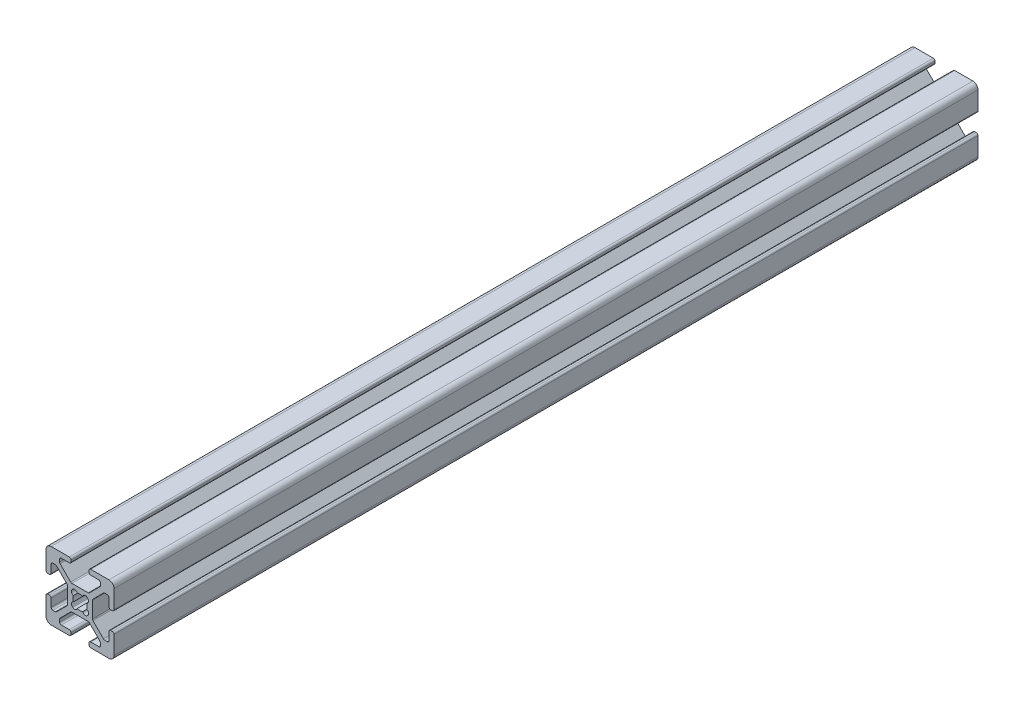
from build123d import *

# Parameters (mm, degrees)
BOSS_EXTRUDE1_DEPTH = 254


with BuildPart() as part:
    # Sketch2 → Boss-Extrude1 (new body)
    with BuildSketch(Plane.XY):
        with BuildLine():
            Line((-10, -3.138), (-10, -8.5))
            ThreePointArc((-10, -8.5), (-9.560660172, -9.560660172), (-8.5, -10))
            Line((-8.5, -10), (-3.138, -10))
            ThreePointArc((-3.138, -10), (-2.778789755, -9.851210245), (-2.63, -9.492))
            Line((-2.63, -9.492), (-2.63, -9.008))
            ThreePointArc((-2.63, -9.008), (-2.778789755, -8.648789755), (-3.138, -8.5))
            Line((-3.138, -8.5), (-5.487, -8.5))
            ThreePointArc((-5.487, -8.5), (-5.846210245, -8.351210245), (-5.995, -7.992))
            Line((-5.995, -7.992), (-5.995, -7.266240833))
            ThreePointArc((-5.995, -7.266240833), (-5.956330803, -7.07183765), (-5.846210245, -6.907030588))
            Line((-5.846210245, -6.907030588), (-2.742969412, -3.803789755))
            ThreePointArc((-2.742969412, -3.803789755), (-2.57816235, -3.693669197), (-2.383759167, -3.655))
            Line((-2.383759167, -3.655), (2.38407951, -3.655))
            ThreePointArc((2.38407951, -3.655), (2.578482694, -3.693669197), (2.743289755, -3.803789755))
            Line((2.743289755, -3.803789755), (5.846210245, -6.906710245))
            ThreePointArc((5.846210245, -6.906710245), (5.956330803, -7.071517306), (5.995, -7.26592049))
            Line((5.995, -7.26592049), (5.995, -7.992))
            ThreePointArc((5.995, -7.992), (5.846210245, -8.351210245), (5.487, -8.5))
            Line((5.487, -8.5), (3.138, -8.5))
            ThreePointArc((3.138, -8.5), (2.778789755, -8.648789755), (2.63, -9.008))
            Line((2.63, -9.008), (2.63, -9.492))
            ThreePointArc((2.63, -9.492), (2.778789755, -9.851210245), (3.138, -10))
            Line((3.138, -10), (8.5, -10))
            ThreePointArc((8.5, -10), (9.560660172, -9.560660172), (10, -8.5))
            Line((10, -8.5), (10, -3.138))
            ThreePointArc((10, -3.138), (9.851210245, -2.778789755), (9.492, -2.63))
            Line((9.492, -2.63), (9.008, -2.63))
            ThreePointArc((9.008, -2.63), (8.648789755, -2.778789755), (8.5, -3.138))
            Line((8.5, -3.138), (8.5, -5.487))
            ThreePointArc((8.5, -5.487), (8.351210245, -5.846210245), (7.992, -5.995))
            Line((7.992, -5.995), (7.266240833, -5.995))
            ThreePointArc((7.266240833, -5.995), (7.07183765, -5.956330803), (6.907030588, -5.846210245))
            Line((6.907030588, -5.846210245), (3.803789755, -2.742969412))
            ThreePointArc((3.803789755, -2.742969412), (3.693669197, -2.57816235), (3.655, -2.383759167))
            Line((3.655, -2.383759167), (3.655, 2.38407951))
            ThreePointArc((3.655, 2.38407951), (3.693669197, 2.578482694), (3.803789755, 2.743289755))
            Line((3.803789755, 2.743289755), (6.906710245, 5.846210245))
            ThreePointArc((6.906710245, 5.846210245), (7.071517306, 5.956330803), (7.26592049, 5.995))
            Line((7.26592049, 5.995), (7.992, 5.995))
            ThreePointArc((7.992, 5.995), (8.351210245, 5.846210245), (8.5, 5.487))
            Line((8.5, 5.487), (8.5, 3.138))
            ThreePointArc((8.5, 3.138), (8.648789755, 2.778789755), (9.008, 2.63))
            Line((9.008, 2.63), (9.492, 2.63))
            ThreePointArc((9.492, 2.63), (9.851210245, 2.778789755), (10, 3.138))
            Line((10, 3.138), (10, 8.5))
            ThreePointArc((10, 8.5), (9.560660172, 9.560660172), (8.5, 10))
            Line((8.5, 10), (3.138, 10))
            ThreePointArc((3.138, 10), (2.778789755, 9.851210245), (2.63, 9.492))
            Line((2.63, 9.492), (2.63, 9.008))
            ThreePointArc((2.63, 9.008), (2.778789755, 8.648789755), (3.138, 8.5))
            Line((3.138, 8.5), (5.487, 8.5))
            ThreePointArc((5.487, 8.5), (5.846210245, 8.351210245), (5.995, 7.992))
            Line((5.995, 7.992), (5.995, 7.266240833))
            ThreePointArc((5.995, 7.266240833), (5.956330803, 7.07183765), (5.846210245, 6.907030588))
            Line((5.846210245, 6.907030588), (2.742969412, 3.803789755))
            ThreePointArc((2.742969412, 3.803789755), (2.57816235, 3.693669197), (2.383759167, 3.655))
            Line((2.383759167, 3.655), (-2.38407951, 3.655))
            ThreePointArc((-2.38407951, 3.655), (-2.578482694, 3.693669197), (-2.743289755, 3.803789755))
            Line((-2.743289755, 3.803789755), (-5.846210245, 6.906710245))
            ThreePointArc((-5.846210245, 6.906710245), (-5.956330803, 7.071517306), (-5.995, 7.26592049))
            Line((-5.995, 7.26592049), (-5.995, 7.992))
            ThreePointArc((-5.995, 7.992), (-5.846210245, 8.351210245), (-5.487, 8.5))
            Line((-5.487, 8.5), (-3.138, 8.5))
            ThreePointArc((-3.138, 8.5), (-2.778789755, 8.648789755), (-2.63, 9.008))
            Line((-2.63, 9.008), (-2.63, 9.492))
            ThreePointArc((-2.63, 9.492), (-2.778789755, 9.851210245), (-3.138, 10))
            Line((-3.138, 10), (-8.5, 10))
            ThreePointArc((-8.5, 10), (-9.560660172, 9.560660172), (-10, 8.5))
            Line((-10, 8.5), (-10, 3.138))
            ThreePointArc((-10, 3.138), (-9.851210245, 2.778789755), (-9.492, 2.63))
            Line((-9.492, 2.63), (-9.008, 2.63))
            ThreePointArc((-9.008, 2.63), (-8.648789755, 2.778789755), (-8.5, 3.138))
            Line((-8.5, 3.138), (-8.5, 5.487))
            ThreePointArc((-8.5, 5.487), (-8.351210245, 5.846210245), (-7.992, 5.995))
            Line((-7.992, 5.995), (-7.266240833, 5.995))
            ThreePointArc((-7.266240833, 5.995), (-7.07183765, 5.956330803), (-6.907030588, 5.846210245))
            Line((-6.907030588, 5.846210245), (-3.803789755, 2.742969412))
            ThreePointArc((-3.803789755, 2.742969412), (-3.693669197, 2.57816235), (-3.655, 2.383759167))
            Line((-3.655, 2.383759167), (-3.655, -2.38407951))
            ThreePointArc((-3.655, -2.38407951), (-3.693669197, -2.578482694), (-3.803789755, -2.743289755))
            Line((-3.803789755, -2.743289755), (-6.906710245, -5.846210245))
            ThreePointArc((-6.906710245, -5.846210245), (-7.071517306, -5.956330803), (-7.26592049, -5.995))
            Line((-7.26592049, -5.995), (-7.992, -5.995))
            ThreePointArc((-7.992, -5.995), (-8.351210245, -5.846210245), (-8.5, -5.487))
            Line((-8.5, -5.487), (-8.5, -3.138))
            ThreePointArc((-8.5, -3.138), (-8.648789755, -2.778789755), (-9.008, -2.63))
            Line((-9.008, -2.63), (-9.492, -2.63))
            ThreePointArc((-9.492, -2.63), (-9.851210245, -2.778789755), (-10, -3.138))
        make_face()
        with BuildLine():
            Line((-2.124493037, 2.304493037), (-2.304493037, 2.124493037))
            ThreePointArc((-2.304493037, 2.124493037), (-2.506016078, 1.35638567), (-1.935777391, 0.803729988))
            ThreePointArc((-1.935777391, 0.803729988), (-2.096, 0), (-1.935777391, -0.803729988))
            ThreePointArc((-1.935777391, -0.803729988), (-2.506016078, -1.35638567), (-2.304493037, -2.124493037))
            Line((-2.304493037, -2.124493037), (-2.124493037, -2.304493037))
            ThreePointArc((-2.124493037, -2.304493037), (-1.35638567, -2.506016078), (-0.803729988, -1.935777391))
            ThreePointArc((-0.803729988, -1.935777391), (0, -2.096), (0.803729988, -1.935777391))
            ThreePointArc((0.803729988, -1.935777391), (1.35638567, -2.506016078), (2.124493037, -2.304493037))
            Line((2.124493037, -2.304493037), (2.304493037, -2.124493037))
            ThreePointArc((2.304493037, -2.124493037), (2.506016078, -1.35638567), (1.935777391, -0.803729988))
            ThreePointArc((1.935777391, -0.803729988), (2.096, 0), (1.935777391, 0.803729988))
            ThreePointArc((1.935777391, 0.803729988), (2.506016078, 1.35638567), (2.304493037, 2.124493037))
            Line((2.304493037, 2.124493037), (2.124493037, 2.304493037))
            ThreePointArc((2.124493037, 2.304493037), (1.35638567, 2.506016078), (0.803729988, 1.935777391))
            ThreePointArc((0.803729988, 1.935777391), (0, 2.096), (-0.803729988, 1.935777391))
            ThreePointArc((-0.803729988, 1.935777391), (-1.35638567, 2.506016078), (-2.124493037, 2.304493037))
        make_face(mode=Mode.SUBTRACT)
    extrude(amount=-BOSS_EXTRUDE1_DEPTH)


solid = part.part
